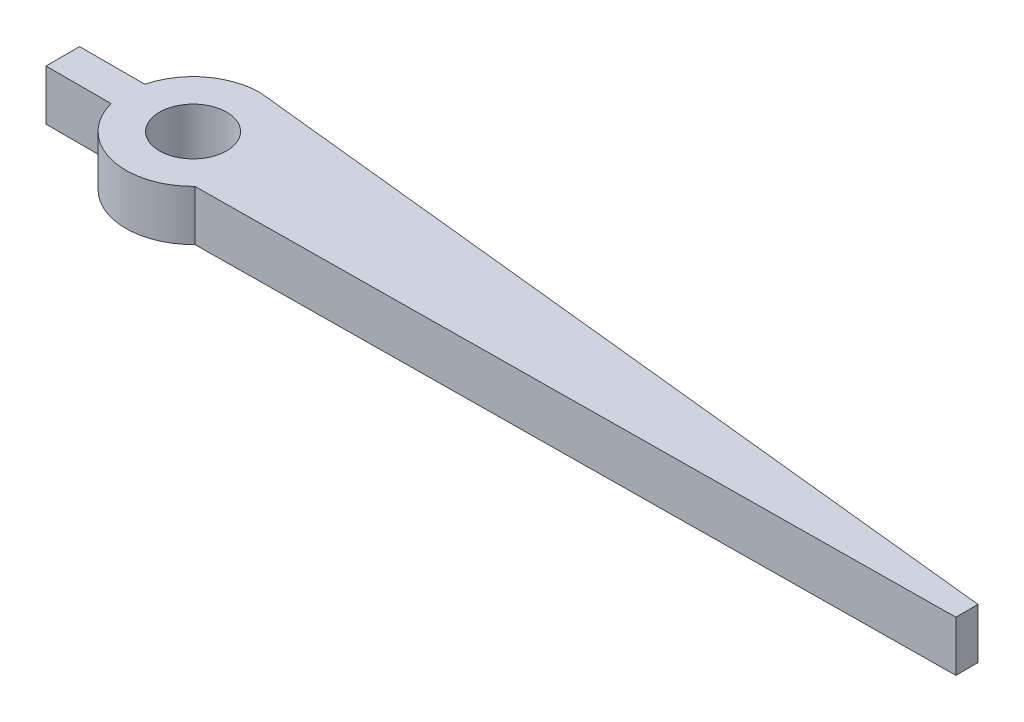
from build123d import *

# Parameters (mm, degrees)
SKETCH1_R           = 1
BOSS_EXTRUDE1_DEPTH = 1.5


with BuildPart() as part:
    # Sketch1 → Boss-Extrude1 (new body)
    # profile 1 of 3: a face of its own
    with BuildSketch(Plane(origin=(0, 0, 0), x_dir=(1, 0, 0), z_dir=(0, 1, 0))):
        with BuildLine():
            ThreePointArc((-38.479582276, 15.672906391), (-38.624558781, 14.925318383), (-39.038470107, 14.28611307))
            Line((-39.038470107, 14.28611307), (-16.611056788, 14.505213721))
            Line((-16.611056788, 14.505213721), (-16.611056788, 15.164223273))
            Line((-16.611056788, 15.164223273), (-40.063758895, 17.629201593))
            ThreePointArc((-40.063758895, 17.629201593), (-38.925290354, 16.931547173), (-38.479582276, 15.672906391))
        make_face()
    # profile 2 of 3: a face of its own
    with BuildSketch(Plane(origin=(0, 0, 0), x_dir=(1, 0, 0), z_dir=(0, 1, 0))):
        with BuildLine():
            ThreePointArc((-40.479582276, 17.672906391), (-41.704327148, 17.254045221), (-42.41607395, 16.172906391))
            ThreePointArc((-42.41607395, 16.172906391), (-42.479582276, 15.672906391), (-42.41607395, 15.172906391))
            ThreePointArc((-42.41607395, 15.172906391), (-40.987470858, 13.738468698), (-39.038470107, 14.28611307))
            ThreePointArc((-39.038470107, 14.28611307), (-38.624558781, 14.925318383), (-38.479582276, 15.672906391))
            ThreePointArc((-38.479582276, 15.672906391), (-38.925290354, 16.931547173), (-40.063758895, 17.629201593))
            Line((-40.063758895, 17.629201593), (-40.479582276, 17.672906391))
        make_face()
        with Locations(Location((-40.479582276, 15.672906391, 0), (0, 0, 270))):
            Circle(SKETCH1_R, mode=Mode.SUBTRACT)
    # profile 3 of 3: a face of its own
    with BuildSketch(Plane(origin=(0, 0, 0), x_dir=(1, 0, 0), z_dir=(0, 1, 0))):
        with BuildLine():
            Line((-42.41607395, 16.172906391), (-44.35607395, 16.172906391))
            Line((-44.35607395, 16.172906391), (-44.35607395, 15.172906391))
            Line((-44.35607395, 15.172906391), (-42.41607395, 15.172906391))
            ThreePointArc((-42.41607395, 15.172906391), (-42.479582276, 15.672906391), (-42.41607395, 16.172906391))
        make_face()
    extrude(amount=BOSS_EXTRUDE1_DEPTH)


solid = part.part
